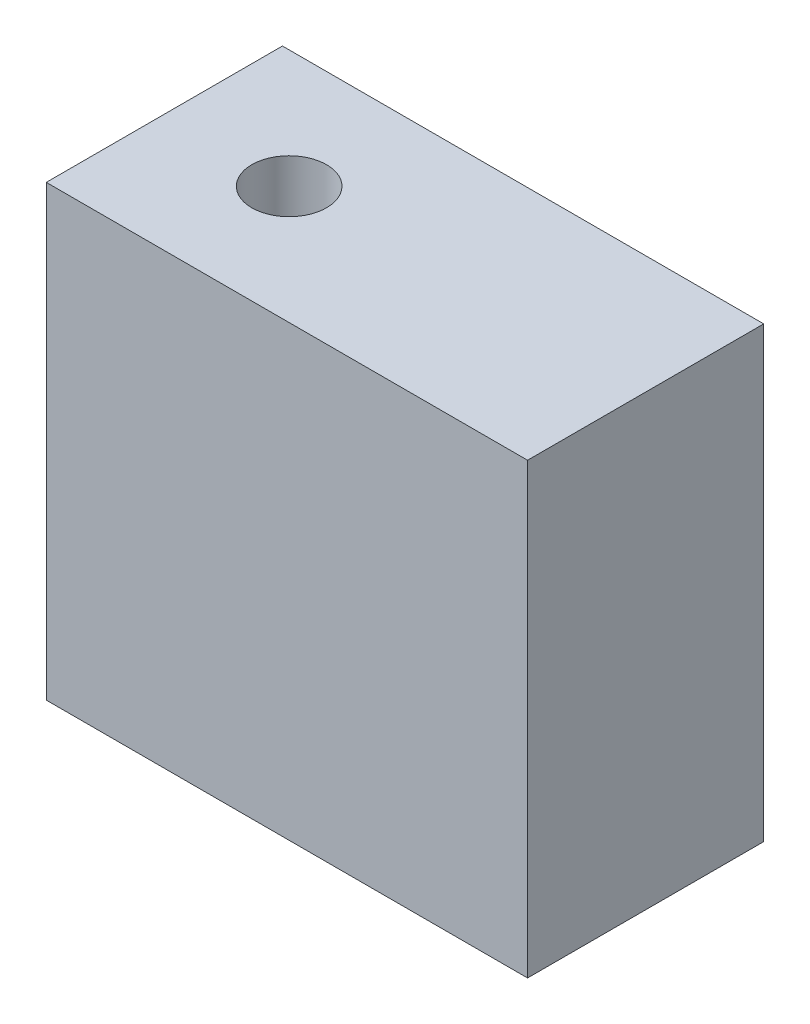
from build123d import *

# Parameters (mm, degrees)
SKETCH1_W           = 40.894
SKETCH1_H           = 20.066
BOSS_EXTRUDE1_DEPTH = 38.1
SKETCH2_R           = 3.175
CUT_EXTRUDE1_DEPTH  = 12.7


with BuildPart() as part:
    # Sketch1 → Boss-Extrude1 (new body)
    with BuildSketch(Plane(origin=(0, 0, 0), x_dir=(1, 0, 0), z_dir=(0, 1, 0))):
        with Locations((-20.447, -10.033)):
            Rectangle(SKETCH1_W, SKETCH1_H)
    extrude(amount=BOSS_EXTRUDE1_DEPTH)

    # Sketch2 → Cut-Extrude1 (cut)
    with BuildSketch(Plane(origin=(0, 38.1, 0), x_dir=(1, 0, 0), z_dir=(0, 1, 0))):
        with Locations(Location((-30.2895, -10.033, 0), (0, 0, 270))):
            Circle(SKETCH2_R)
    extrude(amount=-CUT_EXTRUDE1_DEPTH, mode=Mode.SUBTRACT)


solid = part.part
